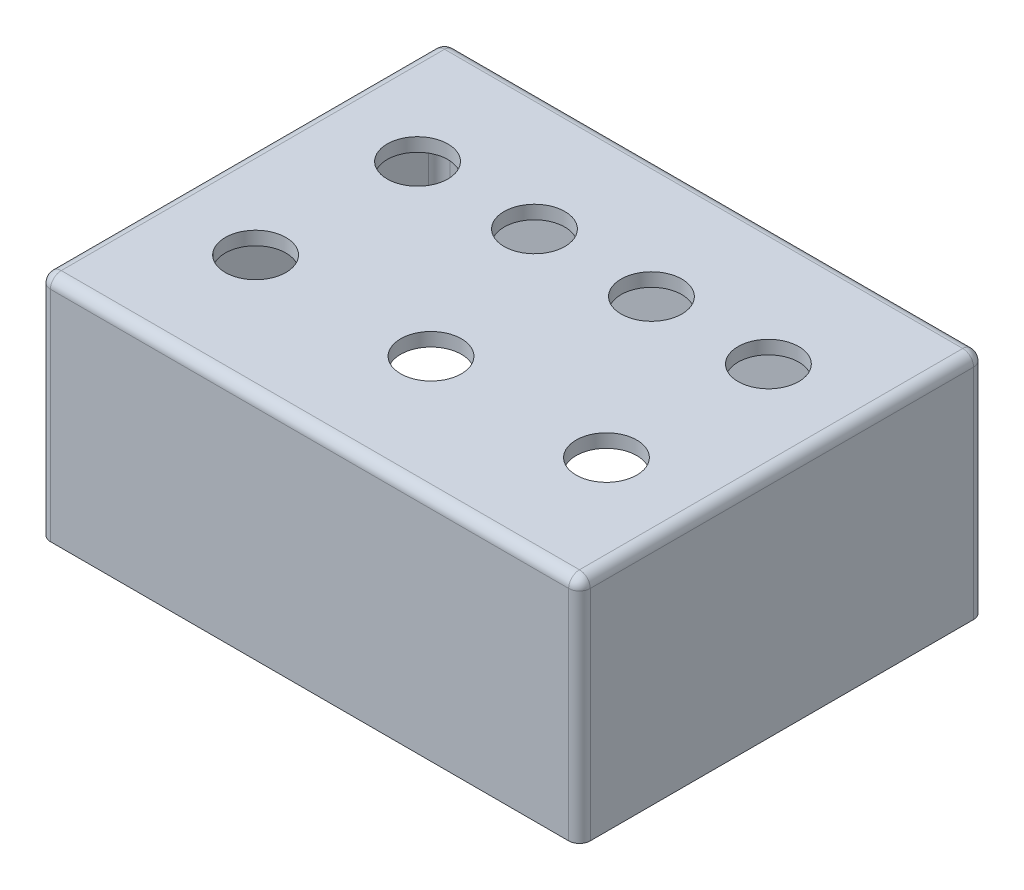
from build123d import *

# Parameters (mm, degrees)
ESBO_O1_W                = 200
ESBO_O1_H                = 150
RESSALTO_EXTRUS_O1_DEPTH = 5
ESBO_O2_W                = 3
ESBO_O2_H                = 150
RESSALTO_EXTRUS_O2_DEPTH = 80
ESBO_O3_R                = 11.25
CORTE_EXTRUS_O1_DEPTH    = 5
ESBO_O6_W                = 194
ESBO_O6_H                = 5
RESSALTO_EXTRUS_O3_DEPTH = 80
FILETE2_R                = 4
FILETE3_R                = 4
ESBO_O12_R               = 14.229327837
CORTE_EXTRUS_O3_DEPTH    = 5


with BuildPart() as part:
    # Esboço1 → Ressalto-extrusão1 (new body)
    with BuildSketch(Plane(origin=(0, 0, 0), x_dir=(1, 0, 0), z_dir=(0, 1, 0))):
        Rectangle(ESBO_O1_W, ESBO_O1_H)
    extrude(amount=RESSALTO_EXTRUS_O1_DEPTH)

    # Esboço2 → Ressalto-extrusão2 (add)
    with BuildSketch(Plane.XZ):
        with Locations((-98.5, 0)):
            Rectangle(ESBO_O2_W, ESBO_O2_H)
        with Locations((98.5, 0)):
            Rectangle(ESBO_O2_W, ESBO_O2_H)
    extrude(amount=RESSALTO_EXTRUS_O2_DEPTH)

    # Esboço3 → Corte-extrusão1 (cut)
    with BuildSketch(Plane(origin=(0, 5, 0), x_dir=(1, 0, 0), z_dir=(0, 1, 0))):
        with Locations(Location((-65, 30, 0), (0, 0, 270))):
            Circle(ESBO_O3_R)
        with Locations(Location((-21.666666667, 30, 0), (0, 0, 270))):
            Circle(ESBO_O3_R)
        with Locations(Location((21.666666667, 30, 0), (0, 0, 270))):
            Circle(ESBO_O3_R)
        with Locations(Location((65, 30, 0), (0, 0, 270))):
            Circle(ESBO_O3_R)
        with Locations(Location((-65, -30, 0), (0, 0, 270))):
            Circle(ESBO_O3_R)
        with Locations(Location((0, -30, 0), (0, 0, 270))):
            Circle(ESBO_O3_R)
        with Locations(Location((65, -30, 0), (0, 0, 270))):
            Circle(ESBO_O3_R)
    extrude(amount=-CORTE_EXTRUS_O1_DEPTH, mode=Mode.SUBTRACT)

    # Esboço6 → Ressalto-extrusão3 (add)
    with BuildSketch(Plane.XZ):
        with Locations((0, -72.5)):
            Rectangle(ESBO_O6_W, ESBO_O6_H)
        with Locations((0, 72.5)):
            Rectangle(ESBO_O6_W, ESBO_O6_H)
    extrude(amount=RESSALTO_EXTRUS_O3_DEPTH)

    # Filete2
    filete2_edges = [part.edges().sort_by_distance(p)[0] for p in [
        (100, 5, 0),
        (0, 5, -75),
        (-100, 5, 0),
        (-100, -37.5, -75),
        (100, -37.5, -75),
        (100, -37.5, 75),
        (-100, -37.5, 75),
        (0, 5, 75),
    ]]
    fillet(filete2_edges, radius=FILETE2_R)

    # Filete3
    filete3_edges = [part.edges().sort_by_distance(p)[0] for p in [
        (-97, 0, 0),
        (97, 0, 0),
        (-97, -40, -70),
        (0, 0, -70),
        (97, -40, -70),
        (0, 0, 70),
        (-97, -40, 70),
        (97, -40, 70),
    ]]
    fillet(filete3_edges, radius=FILETE3_R)

    # Esboço12 → Corte-extrusão3 (cut)
    with BuildSketch(Plane(origin=(0, 0, -75), x_dir=(-1, 0, 0), z_dir=(0, 0, -1))):
        with Locations((0, -55.444674629)):
            Circle(ESBO_O12_R)
    extrude(amount=-CORTE_EXTRUS_O3_DEPTH, mode=Mode.SUBTRACT)


solid = part.part
